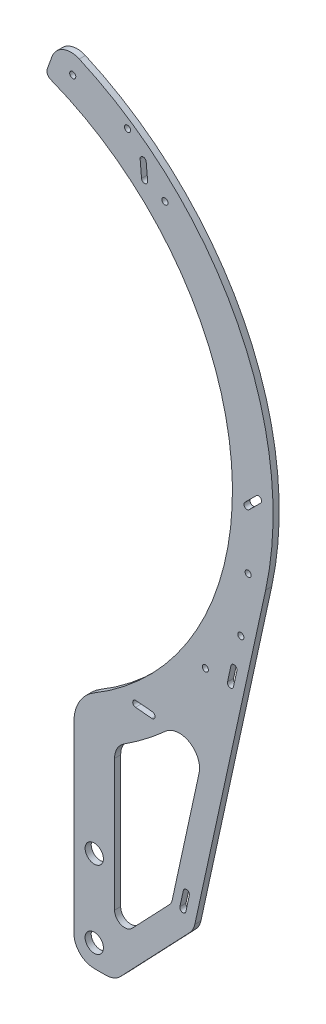
from build123d import *

# Parameters (mm, degrees)
SKETCH_1_W          = 20
SKETCH_1_H          = 60
SKETCH_1_R          = 4.5
EXTRUDE_1_DEPTH     = 3
EXTRUDE_START       = -3
EXTRUDE_2_DEPTH     = 3
FILLET_2_R          = 20
FILLET_3_R          = 10
FILLET_4_R          = 3
FILLET_5_R          = 10
CUT_EXTRUDE_1_DEPTH = 384.952760264
CUT_EXTRUDE_2_DEPTH = 384.952760264
SKETCH_5_R          = 1.5
CUT_EXTRUDE_3_DEPTH = 384.952760264
CUT_EXTRUDE_4_DEPTH = 384.952760264
EXTRUDE_3_DEPTH     = 3
FILLET_6_R          = 10
FILLET_7_R          = 5
SKETCH_8_R          = 1.5
CUT_EXTRUDE_5_DEPTH = 384.952760264


with BuildPart() as part:
    # 草图1 → 凸台-拉伸1 (new body)
    # profile 1 of 4: a face of its own
    with BuildSketch(Plane.XY):
        with BuildLine():
            ThreePointArc((88, 226.5), (59.064327086, 318.272229816), (-17.276777068, 376.850819326))
            Line((-17.276777068, 376.850819326), (-24.117179934, 358.05696691))
            ThreePointArc((-24.117179934, 358.05696691), (42.6812862, 306.800701089), (68, 226.5))
            ThreePointArc((68, 226.5), (52.659536338, 162.781870712), (10, 113.02753638))
            Line((10, 113.02753638), (10, 89.110044035))
            ThreePointArc((10, 89.110044035), (67.140217047, 147.506329367), (88, 226.5))
        make_face()
    # profile 2 of 4: a face of its own
    with BuildSketch(Plane.XY):
        with BuildLine():
            Line((-10, 100.977093724), (-10, 79.00084746))
            ThreePointArc((-10, 79.00084746), (0.177205293, 83.704863402), (10, 89.110044035))
            Line((10, 89.110044035), (10, 113.02753638))
            ThreePointArc((10, 113.02753638), (0.251666362, 106.584626891), (-10, 100.977093724))
        make_face()
    # profile 3 of 4: a face of its own
    with BuildSketch(Plane.XY):
        with BuildLine():
            Line((-10, 79.00084746), (-10, 49))
            Line((-10, 49), (10, 49))
            Line((10, 49), (10, 89.110044035))
            ThreePointArc((10, 89.110044035), (0.177205293, 83.704863402), (-10, 79.00084746))
        make_face()
    # profile 4 of 4: a face of its own
    with BuildSketch(Plane.XY):
        with Locations((0, 19)):
            Rectangle(SKETCH_1_W, SKETCH_1_H)
        with Locations((0, 38)):
            Circle(SKETCH_1_R, mode=Mode.SUBTRACT)
        Circle(SKETCH_1_R, mode=Mode.SUBTRACT)
    extrude(amount=EXTRUDE_1_DEPTH)

    # 草图2 → 凸台-拉伸2 (add)
    with BuildSketch(Plane.XY.offset(3).offset(EXTRUDE_START)):
        with BuildLine():
            Line((10, -1), (10, -11))
            Line((10, -11), (40, -11))
            Line((40, -11), (84.331190721, 192.433024677))
            ThreePointArc((84.331190721, 192.433024677), (74.827433124, 162.925595698), (59.811855282, 135.804714527))
            Line((59.811855282, 135.804714527), (30, -1))
            Line((30, -1), (10, -1))
        make_face()
    extrude(amount=EXTRUDE_2_DEPTH)

    # 圆角2
    fillet_2_edges = [part.edges().sort_by_distance(p)[0] for p in [
        (-10, 100.977093724, 1.5),
    ]]
    fillet(fillet_2_edges, radius=FILLET_2_R)

    # 圆角3
    fillet_3_edges = [part.edges().sort_by_distance(p)[0] for p in [
        (-10, -11, 1.5),
        (40, -11, 1.5),
    ]]
    fillet(fillet_3_edges, radius=FILLET_3_R)

    # 圆角4
    fillet_4_edges = [part.edges().sort_by_distance(p)[0] for p in [
        (-24.117179934, 358.05696691, 1.5),
    ]]
    fillet(fillet_4_edges, radius=FILLET_4_R)

    # 圆角5
    fillet_5_edges = [part.edges().sort_by_distance(p)[0] for p in [
        (-17.276777068, 376.850819326, 1.5),
    ]]
    fillet(fillet_5_edges, radius=FILLET_5_R)

    # 草图3 → 切除-拉伸1 (cut, through all)
    with BuildSketch(Plane(origin=(0, 0, 0), x_dir=(-1, 0, 0), z_dir=(0, 0, -1))):
        Polygon((-46.77842194, 43.588901874), (-43.847212114, 44.227657662), (-42.143863348, 36.411098126), (-45.075073174, 35.772342338), align=None)
        Polygon((-70.199467474, 151.066595495), (-68.496118708, 143.250035959), (-65.564908882, 143.888791747), (-67.268257648, 151.705351283), align=None)
    extrude(amount=-CUT_EXTRUDE_1_DEPTH, mode=Mode.SUBTRACT)

    # 草图4 → 切除-拉伸2 (cut, through all)
    with BuildSketch(Plane(origin=(0, 0, 0), x_dir=(-1, 0, 0), z_dir=(0, 0, -1))):
        Polygon((-28.272186631, 109.750418514), (-28.533653859, 112.739002608), (-20.564096275, 113.43624855), (-20.302629046, 110.447664456), align=None)
        Polygon((-81.889087297, 228.267766953), (-76.232233047, 222.610912703), (-74.110912703, 224.732233047), (-79.767766953, 230.389087297), align=None)
        Polygon((-25.563810529, 345.522178874), (-26.261056471, 337.55262129), (-23.272472377, 337.291154061), (-22.575226435, 345.260711646), align=None)
        Polygon((100.463470173, 377.744196764), (93.910253818, 373.155585273), (95.630983127, 370.69812914), (102.184199482, 375.286740631), align=None)
    extrude(amount=-CUT_EXTRUDE_2_DEPTH, mode=Mode.SUBTRACT)

    # 草图5 → 切除-拉伸3 (cut, through all)
    with BuildSketch(Plane.XY.offset(3)):
        with Locations((72.125207072, 166.801384551)):
            Circle(SKETCH_5_R)
        with Locations((75.700287711, 195.105334687)):
            Circle(SKETCH_5_R)
        with Locations(Location((54.63925576, 144.259505713, 0), (0, 0, 180))):
            Circle(SKETCH_5_R)
        with Locations(Location((34.773123959, 333.273123959, 0), (0, 0, 180))):
            Circle(SKETCH_5_R)
        with Locations((16.35937296, 355.063685425)):
            Circle(SKETCH_5_R)
        with Locations((-10.582766896, 364.445364104)):
            Circle(SKETCH_5_R)
    extrude(amount=-CUT_EXTRUDE_3_DEPTH, mode=Mode.SUBTRACT)

    # 草图6 → 切除-拉伸4 (cut, through all)
    with BuildSketch(Plane(origin=(0, 0, 0), x_dir=(-1, 0, 0), z_dir=(0, 0, -1))):
        Polygon((-48.895829905, 29.822399649), (-37.268809589, 32.356106534), (-10, -1), (-10, -25.455905849), (-44.544329985, -23.840605691), align=None)
    extrude(amount=-CUT_EXTRUDE_4_DEPTH, mode=Mode.SUBTRACT)

    # 草图7 → 凸台-拉伸3 (add)
    with BuildSketch(Plane(origin=(0, 0, 0), x_dir=(-1, 0, 0), z_dir=(0, 0, -1))):
        Polygon((-48.895829905, 29.822399649), (-10, -11), (-10, 6.39592954), (-38.020150061, 35.803960345), (-37.268809589, 32.356106534), align=None)
    extrude(amount=-EXTRUDE_3_DEPTH)

    # 圆角6
    fillet_6_edges = [part.edges().sort_by_distance(p)[0] for p in [
        (10, 89.110044035, 1.5),
        (10, -11, 1.5),
        (48.895829905, 29.822399649, 1.5),
        (59.811855282, 135.804714527, 1.5),
    ]]
    fillet(fillet_6_edges, radius=FILLET_6_R)

    # 圆角7
    fillet_7_edges = [part.edges().sort_by_distance(p)[0] for p in [
        (38.020150061, 35.803960345, 1.5),
        (10, 6.39592954, 1.5),
    ]]
    fillet(fillet_7_edges, radius=FILLET_7_R)

    # 草图8 → 切除-拉伸5 (cut, through all)
    with BuildSketch(Plane(origin=(0, 0, 0), x_dir=(-1, 0, 0), z_dir=(0, 0, -1))):
        with Locations((-43.609468261, 36.091720232)):
            Circle(SKETCH_8_R)
        with Locations((-45.312817027, 43.908279768)):
            Circle(SKETCH_8_R)
        with Locations((-67.030513795, 143.569413853)):
            Circle(SKETCH_8_R)
        with Locations((-68.733862561, 151.385973389)):
            Circle(SKETCH_8_R)
        with Locations((-28.402920245, 111.244710561)):
            Circle(SKETCH_8_R)
        with Locations((-20.433362661, 111.941956503)):
            Circle(SKETCH_8_R)
        with Locations((-75.171572875, 223.671572875)):
            Circle(SKETCH_8_R)
        with Locations((-80.828427125, 229.328427125)):
            Circle(SKETCH_8_R)
        with Locations((-24.766764424, 337.421887675)):
            Circle(SKETCH_8_R)
        with Locations((-24.069518482, 345.39144526)):
            Circle(SKETCH_8_R)
    extrude(amount=-CUT_EXTRUDE_5_DEPTH, mode=Mode.SUBTRACT)


solid = part.part
